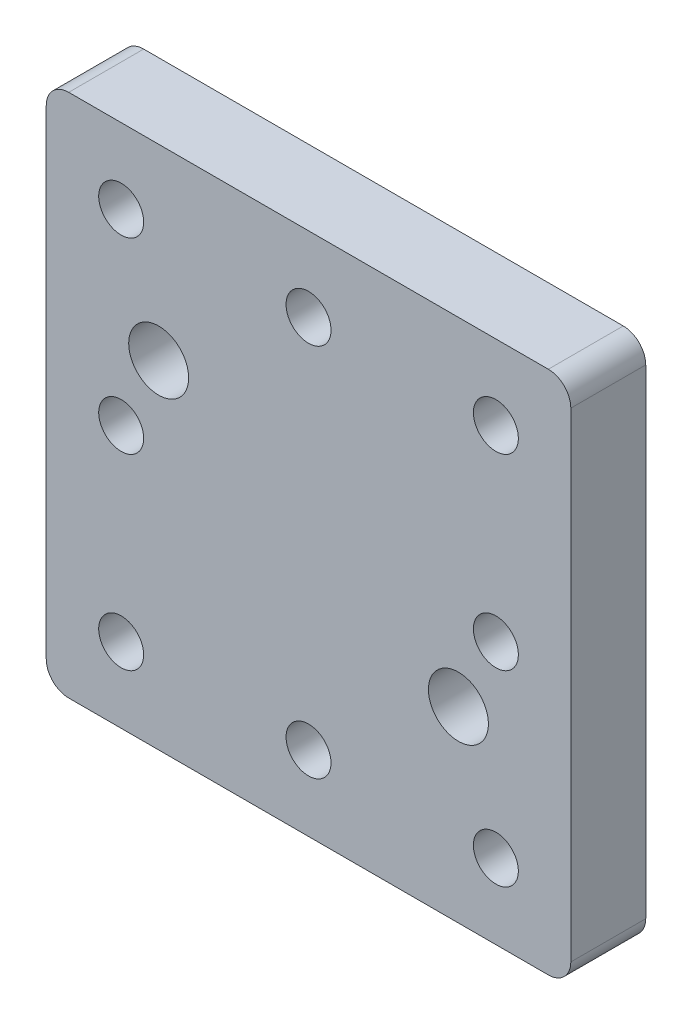
from build123d import *

# Parameters (mm, degrees)
SKETCH1_W           = 70
SKETCH1_H           = 70
BOSS_EXTRUDE1_DEPTH = 10
SKETCH2_R           = 3
CUT_EXTRUDE1_DEPTH  = 10
FILLET1_R           = 3
SKETCH3_R           = 4
CUT_EXTRUDE2_DEPTH  = 10


with BuildPart() as part:
    # Sketch1 → Boss-Extrude1 (new body)
    with BuildSketch(Plane.XY):
        Rectangle(SKETCH1_W, SKETCH1_H)
    extrude(amount=BOSS_EXTRUDE1_DEPTH)

    # Sketch2 → Cut-Extrude1 (cut)
    with BuildSketch(Plane.XY.offset(10)):
        with Locations((0, 25)):
            Circle(SKETCH2_R)
        with Locations((25, 25)):
            Circle(SKETCH2_R)
        with Locations((25, 0)):
            Circle(SKETCH2_R)
        with Locations((-25, 0)):
            Circle(SKETCH2_R)
        with Locations((-25, 25)):
            Circle(SKETCH2_R)
        with Locations((-25, -25)):
            Circle(SKETCH2_R)
        with Locations((0, -25)):
            Circle(SKETCH2_R)
        with Locations((25, -25)):
            Circle(SKETCH2_R)
    extrude(amount=-CUT_EXTRUDE1_DEPTH, mode=Mode.SUBTRACT)

    # Fillet1
    fillet1_edges = [part.edges().sort_by_distance(p)[0] for p in [
        (35, -35, 5),
        (-35, -35, 5),
        (-35, 35, 5),
        (35, 35, 5),
    ]]
    fillet(fillet1_edges, radius=FILLET1_R)

    # Sketch3 → Cut-Extrude2 (cut)
    with BuildSketch(Plane(origin=(0, 0, 0), x_dir=(-1, 0, 0), z_dir=(0, 0, -1))):
        with Locations((20, 10)):
            Circle(SKETCH3_R)
        with Locations((-20, -10)):
            Circle(SKETCH3_R)
    extrude(amount=-CUT_EXTRUDE2_DEPTH, mode=Mode.SUBTRACT)


solid = part.part
